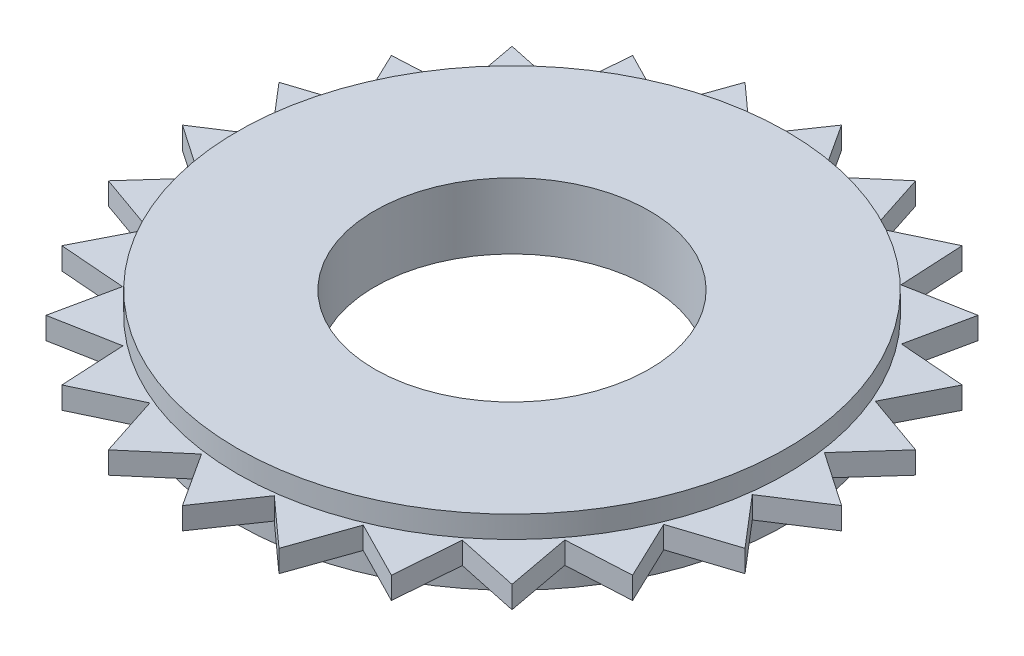
from build123d import *

# Parameters (mm, degrees)
SKETCH1_R           = 25
SKETCH1_R_2         = 12.5
BOSS_EXTRUDE2_DEPTH = 3
BOSS_EXTRUDE3_DEPTH = 1
CIRPATTERN1_COUNT   = 24


with BuildPart() as part:
    # Sketch1 → Boss-Extrude2 (new, symmetric)
    with BuildSketch(Plane(origin=(0, 0, 0), x_dir=(1, 0, 0), z_dir=(0, 1, 0))):
        with Locations(Location((0, 0, 0), (0, 0, 270))):
            Circle(SKETCH1_R)
        with Locations(Location((0, 0, 0), (0, 0, 270))):
            Circle(SKETCH1_R_2, mode=Mode.SUBTRACT)
    extrude(amount=BOSS_EXTRUDE2_DEPTH, both=True)

    # Sketch4 → Boss-Extrude3 (add, symmetric)
    with BuildSketch(Plane(origin=(0, 0, 0), x_dir=(1, 0, 0), z_dir=(0, 1, 0))):
        Polygon((0, 30), (-3.612358793, 24.73764063), (0, 25), (3.394844565, 24.768428097), align=None)
    boss_extrude3 = extrude(amount=BOSS_EXTRUDE3_DEPTH, both=True)

    # CirPattern1: Boss-Extrude3 ×24 about axis
    cirpattern1_axis = Axis((0, 0, 0), (0, 1, 0))
    for i in range(1, CIRPATTERN1_COUNT):
        add(boss_extrude3.rotate(cirpattern1_axis, i * 360 / CIRPATTERN1_COUNT))


solid = part.part
